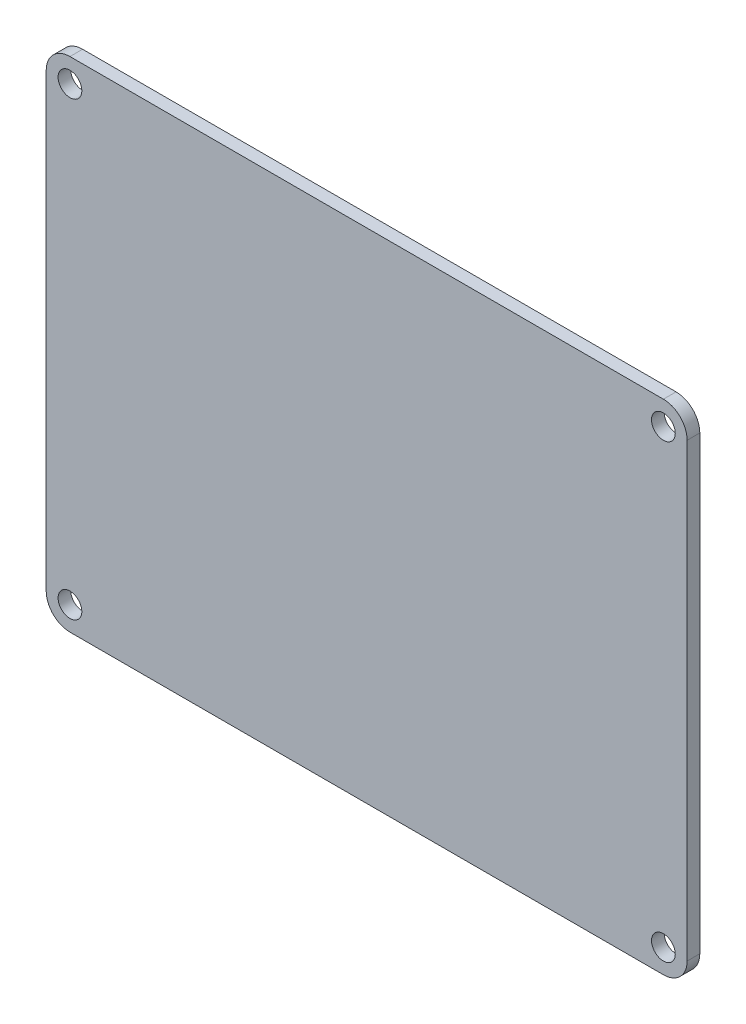
from build123d import *

# Parameters (mm, degrees)
SKETCH1_R           = 1.5
BOSS_EXTRUDE1_DEPTH = 1.6


with BuildPart() as part:
    # Sketch1 → Boss-Extrude1 (new body)
    with BuildSketch(Plane.XY):
        with BuildLine():
            Line((-37.5, -31.5), (37.5, -31.5))
            ThreePointArc((37.5, -31.5), (39.621320344, -30.621320344), (40.5, -28.5))
            Line((40.5, -28.5), (40.5, 28.5))
            ThreePointArc((40.5, 28.5), (39.621320344, 30.621320344), (37.5, 31.5))
            Line((37.5, 31.5), (-37.5, 31.5))
            ThreePointArc((-37.5, 31.5), (-39.621320344, 30.621320344), (-40.5, 28.5))
            Line((-40.5, 28.5), (-40.5, -28.5))
            ThreePointArc((-40.5, -28.5), (-39.621320344, -30.621320344), (-37.5, -31.5))
        make_face()
        with Locations((-37.5, 28.5)):
            Circle(SKETCH1_R, mode=Mode.SUBTRACT)
        with Locations((37.5, 28.5)):
            Circle(SKETCH1_R, mode=Mode.SUBTRACT)
        with Locations((37.5, -28.5)):
            Circle(SKETCH1_R, mode=Mode.SUBTRACT)
        with Locations((-37.5, -28.5)):
            Circle(SKETCH1_R, mode=Mode.SUBTRACT)
    extrude(amount=BOSS_EXTRUDE1_DEPTH)


solid = part.part
